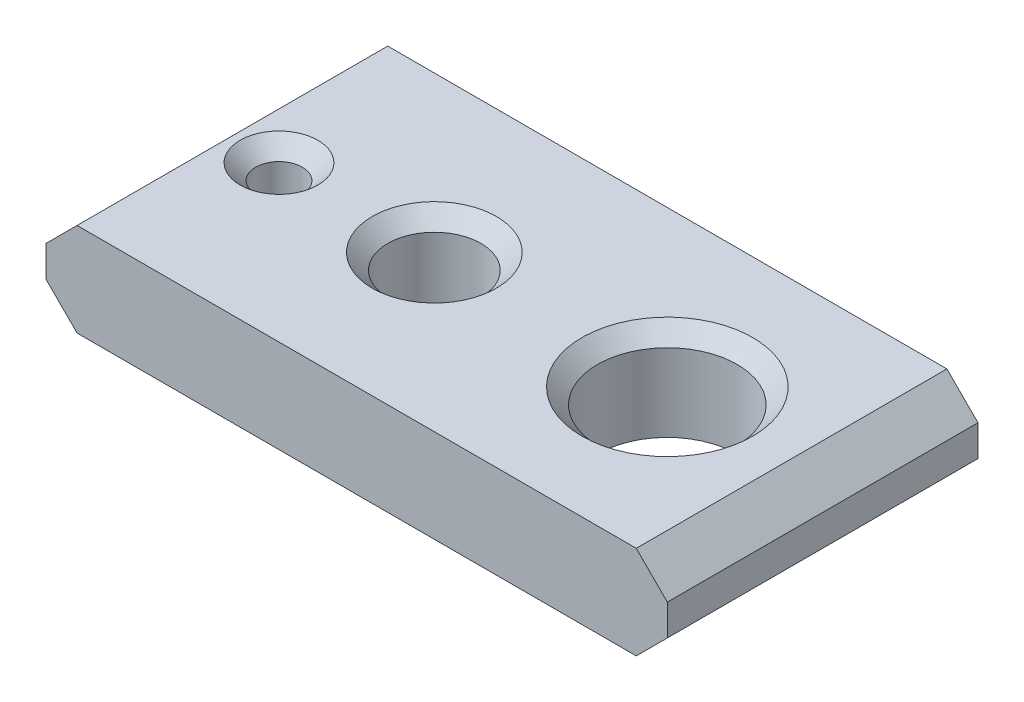
from build123d import *

# Parameters (mm, degrees)
SALIENTE_EXTRUIR1_DEPTH = 100
CROQUIS3_R              = 7.5
CROQUIS3_R_2            = 15
CROQUIS3_R_3            = 22.5
CORTAR_EXTRUIR1_DEPTH   = 226.610283454
CHAFL_N1_SIZE           = 5


with BuildPart() as part:
    # Croquis2 → Saliente-Extruir1 (new body)
    with BuildSketch(Plane.XY):
        Polygon((10, 30), (190, 30), (200, 20), (200, 10), (190, 0), (10, 0), (0, 10), (0, 20), align=None)
    extrude(amount=-SALIENTE_EXTRUIR1_DEPTH)

    # Croquis3 → Cortar-Extruir1 (cut, through all)
    with BuildSketch(Plane(origin=(0, 30, 0), x_dir=(1, 0, 0), z_dir=(0, 1, 0))):
        with Locations(Location((25, 50, 0), (0, 0, 270))):
            Circle(CROQUIS3_R)
        with Locations(Location((75, 50, 0), (0, 0, 270))):
            Circle(CROQUIS3_R_2)
        with Locations(Location((150, 50, 0), (0, 0, 270))):
            Circle(CROQUIS3_R_3)
    extrude(amount=-CORTAR_EXTRUIR1_DEPTH, mode=Mode.SUBTRACT)

    # Chaflán1
    chafl_n1_edges = [part.edges().sort_by_distance(p)[0] for p in [
        (25, 30, -57.5),
        (75, 30, -65),
        (150, 30, -72.5),
    ]]
    chamfer(chafl_n1_edges, length=CHAFL_N1_SIZE)


solid = part.part
